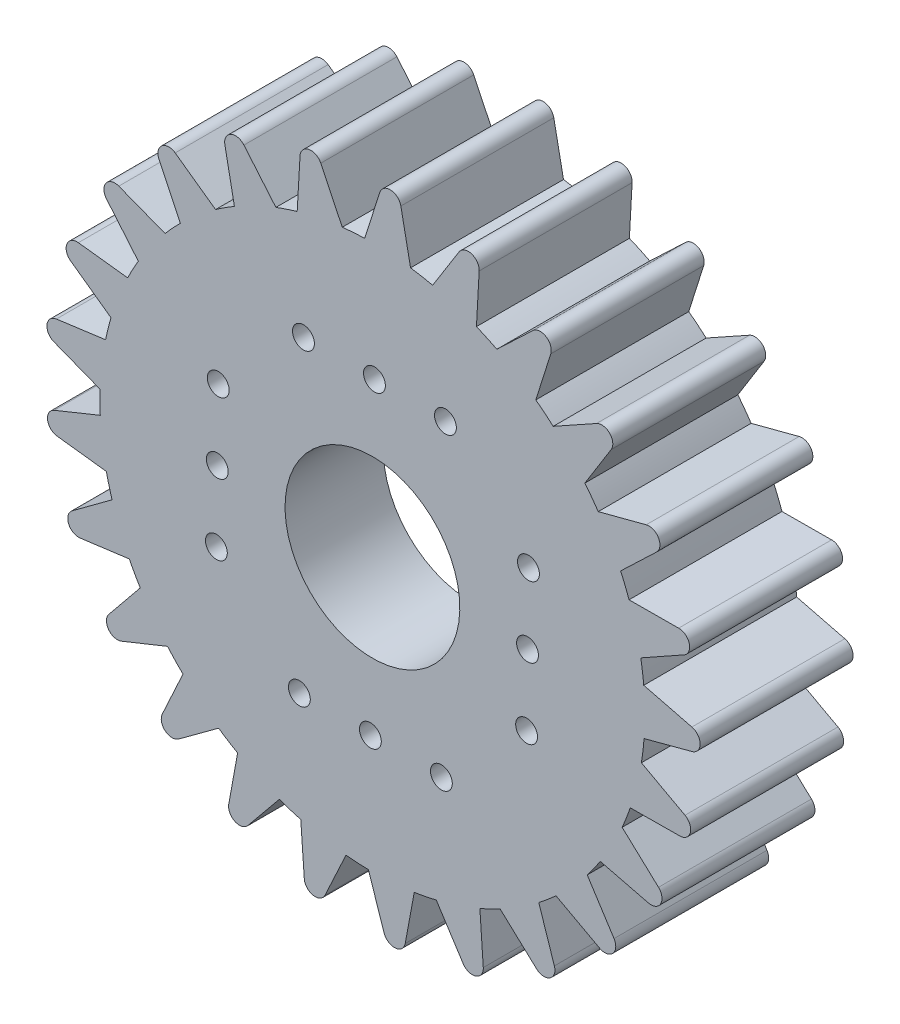
from build123d import *

# Parameters (mm, degrees)
BOSS_EXTRUDE1_DEPTH          = 7
HOLE1_D                      = 8
HOLE1_CBORE_D                = 20.5
HOLE1_CBORE_DEPTH            = 2.5
F_1_0_1_DIAMETER_HOLE1_D     = 1
F_1_0_1_DIAMETER_HOLE1_DEPTH = 7


with BuildPart() as part:
    # Sketch1 → Boss-Extrude1 (new body)
    with BuildSketch(Plane(origin=(0, 0, 74.1), x_dir=(-1, 0, 0), z_dir=(0, 0, -1))):
        with BuildLine():
            Line((5.573417888, 7.249599077), (3.909244984, 5.703911435))
            ThreePointArc((3.909244984, 5.703911435), (3.809726926, 5.099679562), (4.369892407, 4.852263649))
            Line((4.369892407, 4.852263649), (6.574346511, 5.399076092))
            ThreePointArc((6.574346511, 5.399076092), (6.86485582, 4.975241994), (7.172578897, 4.563735604))
            Line((7.172578897, 4.563735604), (5.94508593, 2.65274561))
            ThreePointArc((5.94508593, 2.65274561), (5.998960771, 2.042747658), (6.603057459, 1.942412262))
            Line((6.603057459, 1.942412262), (8.602267858, 3.020271029))
            ThreePointArc((8.602267858, 3.020271029), (8.989053537, 2.681999186), (9.389446406, 2.359948643))
            Line((9.389446406, 2.359948643), (8.675761274, 0.203730826))
            ThreePointArc((8.675761274, 0.203730826), (8.87964386, -0.37370479), (9.489714138, -0.320655229))
            Line((9.489714138, -0.320655229), (11.158063091, 1.220524032))
            ThreePointArc((11.158063091, 1.220524032), (11.616821973, 0.989069307), (12.084726477, 0.776710232))
            Line((12.084726477, 0.776710232), (11.92969264, -1.489252312))
            ThreePointArc((11.92969264, -1.489252312), (12.270772279, -1.997843189), (12.848483188, -1.794741969))
            Line((12.848483188, -1.794741969), (14.081142194, 0.112919824))
            ThreePointArc((14.081142194, 0.112919824), (14.583048772, 0.00282537), (15.089064749, -0.086498936))
            Line((15.089064749, -0.086498936), (15.502423555, -2.319827447))
            ThreePointArc((15.502423555, -2.319827447), (15.959268957, -2.72761695), (16.468320796, -2.387225667))
            Line((16.468320796, -2.387225667), (17.187837357, -0.232946748))
            ThreePointArc((17.187837357, -0.232946748), (17.701354994, -0.214763292), (18.213687601, -0.175440255))
            Line((18.213687601, -0.175440255), (19.169466196, -2.235806489))
            ThreePointArc((19.169466196, -2.235806489), (19.713372085, -2.517171704), (20.121779254, -2.060878394))
            Line((20.121779254, -2.060878394), (20.282943498, 0.204656383))
            ThreePointArc((20.282943498, 0.204656383), (20.775805993, 0.349975216), (21.262263487, 0.515474786))
            Line((21.262263487, 0.515474786), (22.700406786, -1.242468784))
            ThreePointArc((22.700406786, -1.242468784), (23.297197554, -1.379730498), (23.57929833, -0.83620575))
            Line((23.57929833, -0.83620575), (23.171983715, 1.398233005))
            ThreePointArc((23.171983715, 1.398233005), (23.613222703, 1.661556297), (24.043239171, 1.942833453))
            Line((24.043239171, 1.942833453), (25.873383342, 0.597770608))
            ThreePointArc((25.873383342, 0.597770608), (26.485560432, 0.613237052), (26.623629384, 1.209841581))
            Line((26.623629384, 1.209841581), (25.673428985, 3.272786307))
            ThreePointArc((25.673428985, 3.272786307), (26.0353198, 3.637568488), (26.381875725, 4.016949552))
            Line((26.381875725, 4.016949552), (28.489026078, 3.169282677))
            ThreePointArc((28.489026078, 3.169282677), (29.078124151, 3.336505465), (29.063485901, 3.948702919))
            Line((29.063485901, 3.948702919), (27.630104303, 5.710531213))
            ThreePointArc((27.630104303, 5.710531213), (27.889908013, 6.153851676), (28.131228013, 6.607498741))
            Line((28.131228013, 6.607498741), (30.382984542, 6.310489863))
            ThreePointArc((30.382984542, 6.310489863), (30.911988399, 6.618961773), (30.745562721, 7.208285533))
            Line((30.745562721, 7.208285533), (28.919064562, 8.558295243))
            ThreePointArc((28.919064562, 8.558295243), (29.060456745, 9.052298535), (29.181377796, 9.551707286))
            Line((29.181377796, 9.551707286), (31.436254358, 9.824018565))
            ThreePointArc((31.436254358, 9.824018565), (31.871924741, 10.254357173), (31.564168772, 10.783777859))
            Line((31.564168772, 10.783777859), (29.459319649, 11.637142911))
            ThreePointArc((29.459319649, 11.637142911), (29.473416113, 12.150788987), (29.466340301, 12.664579737))
            Line((29.466340301, 12.664579737), (31.582654708, 13.489100854))
            ThreePointArc((31.582654708, 13.489100854), (31.897616846, 14.014266401), (31.467868026, 14.450518566))
            Line((31.467868026, 14.450518566), (29.21692335, 14.753618895))
            ThreePointArc((29.21692335, 14.753618895), (29.102838363, 15.254633483), (28.968210287, 15.750522868))
            Line((28.968210287, 15.750522868), (30.812986722, 17.07544613))
            ThreePointArc((30.812986722, 17.07544613), (30.987450384, 17.662440534), (30.462711412, 17.97811285))
            Line((30.462711412, 17.97811285), (28.207106316, 17.711903547))
            ThreePointArc((28.207106316, 17.711903547), (27.972008257, 18.168806058), (27.718287094, 18.615635525))
            Line((27.718287094, 18.615635525), (29.175611469, 20.357711129))
            ThreePointArc((29.175611469, 20.357711129), (29.198614462, 20.969651374), (28.611856617, 21.144908987))
            Line((28.611856617, 21.144908987), (26.493319064, 20.326116962))
            ThreePointArc((26.493319064, 20.326116962), (26.151980009, 20.710198531), (25.795107994, 21.079892141))
            Line((25.795107994, 21.079892141), (26.773411257, 23.129659071))
            ThreePointArc((26.773411257, 23.129659071), (26.643508219, 23.728094699), (26.031599654, 23.75192553))
            Line((26.031599654, 23.75192553), (24.183245151, 22.431998497))
            ThreePointArc((24.183245151, 22.431998497), (23.757112689, 22.719125866), (23.319513401, 22.988454411))
            Line((23.319513401, 22.988454411), (23.757325162, 25.217118272))
            ThreePointArc((23.757325162, 25.217118272), (23.482678378, 25.764447372), (22.88406756, 25.635354042))
            Line((22.88406756, 25.635354042), (21.422035016, 23.897227871))
            ThreePointArc((21.422035016, 23.897227871), (20.937884616, 24.069359772), (20.44705403, 24.221400348))
            Line((20.44705403, 24.221400348), (20.316864965, 26.488925992))
            ThreePointArc((20.316864965, 26.488925992), (19.914731502, 26.950757865), (19.367031349, 26.676851782))
            Line((19.367031349, 26.676851782), (18.383185648, 24.629739333))
            ThreePointArc((18.383185648, 24.629739333), (17.87143826, 24.676060085), (17.358217065, 24.701259423))
            Line((17.358217065, 24.701259423), (16.668207433, 26.865169876))
            ThreePointArc((16.668207433, 26.865169876), (16.163854816, 27.212485926), (15.701479344, 26.810977617))
            Line((15.701479344, 26.810977617), (15.257639128, 24.583506493))
            ThreePointArc((15.257639128, 24.583506493), (14.750449723, 24.501105593), (14.247085495, 24.397880327))
            Line((14.247085495, 24.397880327), (13.040611138, 26.322209137))
            ThreePointArc((13.040611138, 26.322209137), (12.465729697, 26.533186219), (12.117731656, 26.029303927))
            Line((12.117731656, 26.029303927), (12.241785039, 23.761434332))
            ThreePointArc((12.241785039, 23.761434332), (11.771022192, 23.555489332), (11.309143157, 23.330325485))
            Line((11.309143157, 23.330325485), (9.662011296, 24.894159994))
            ThreePointArc((9.662011296, 24.894159994), (9.052722946, 24.955541642), (8.840968333, 24.380946146))
            Line((8.840968333, 24.380946146), (9.525120585, 22.215176667))
            ThreePointArc((9.525120585, 22.215176667), (9.120364058, 21.898627848), (8.728991773, 21.565673292))
            Line((8.728991773, 21.565673292), (6.744697761, 22.670752028))
            ThreePointArc((6.744697761, 22.670752028), (6.139286329, 22.578681408), (6.077080467, 21.969476655))
            Line((6.077080467, 21.969476655), (7.278343785, 20.041890553))
            ThreePointArc((7.278343785, 20.041890553), (6.965025918, 19.634627842), (6.668751745, 19.214803336))
            Line((6.668751745, 19.214803336), (4.471976071, 19.791690138))
            ThreePointArc((4.471976071, 19.791690138), (3.908481786, 19.551952385), (3.999733295, 18.94641695))
            Line((3.999733295, 18.94641695), (5.642627888, 17.378131549))
            ThreePointArc((5.642627888, 17.378131549), (5.440435595, 16.905744761), (5.257875529, 16.425429423))
            Line((5.257875529, 16.425429423), (2.986649689, 16.43787637))
            ThreePointArc((2.986649689, 16.43787637), (2.500478968, 16.065535089), (2.739454182, 15.501716992))
            Line((2.739454182, 15.501716992), (4.72075094, 14.391273431))
            ThreePointArc((4.72075094, 14.391273431), (4.642388707, 13.883444364), (4.585013668, 13.372818174))
            Line((4.585013668, 13.372818174), (2.382047135, 12.820043179))
            ThreePointArc((2.382047135, 12.820043179), (2.003747871, 12.338493942), (2.375431099, 11.851819947))
            Line((2.375431099, 11.851819947), (4.570637859, 11.26899148))
            ThreePointArc((4.570637859, 11.26899148), (4.621029474, 10.757628901), (4.692444547, 10.24877638))
            Line((4.692444547, 10.24877638), (2.696157809, 9.16551233))
            ThreePointArc((2.696157809, 9.16551233), (2.449499938, 8.605012646), (2.930536955, 8.226062269))
            Line((2.930536955, 8.226062269), (5.201720804, 8.207470152))
            ThreePointArc((5.201720804, 8.207470152), (5.377699975, 7.724704854), (5.573417888, 7.249599077))
        make_face()
    extrude(amount=-BOSS_EXTRUDE1_DEPTH)

    # Hole1 (through all)
    with Locations(Plane(origin=(0, 0, 74.1), x_dir=(-1, 0, 0), z_dir=(0, 0, -1))):
        with Locations((17.003397692, 12.235998762)):
            CounterBoreHole(HOLE1_D / 2, HOLE1_CBORE_D / 2, HOLE1_CBORE_DEPTH)

    # Ø1.0 (1) Diameter Hole1
    with Locations(Plane.XY.offset(81.1)):
        with Locations((-13.846779088, 5.093992112), (-17.096499658, 5.136609209), (-20.346220228, 5.179226306), (-24.145404342, 9.079380158), (-24.102787245, 12.329100728), (-24.060170148, 15.578821298), (-20.160016296, 19.378005412), (-16.910295726, 19.335388315), (-13.660575156, 19.292771218), (-9.861391042, 15.392617366), (-9.904008139, 12.142896796), (-9.946625236, 8.893176226)):
            Hole(F_1_0_1_DIAMETER_HOLE1_D / 2, depth=F_1_0_1_DIAMETER_HOLE1_DEPTH)


solid = part.part
